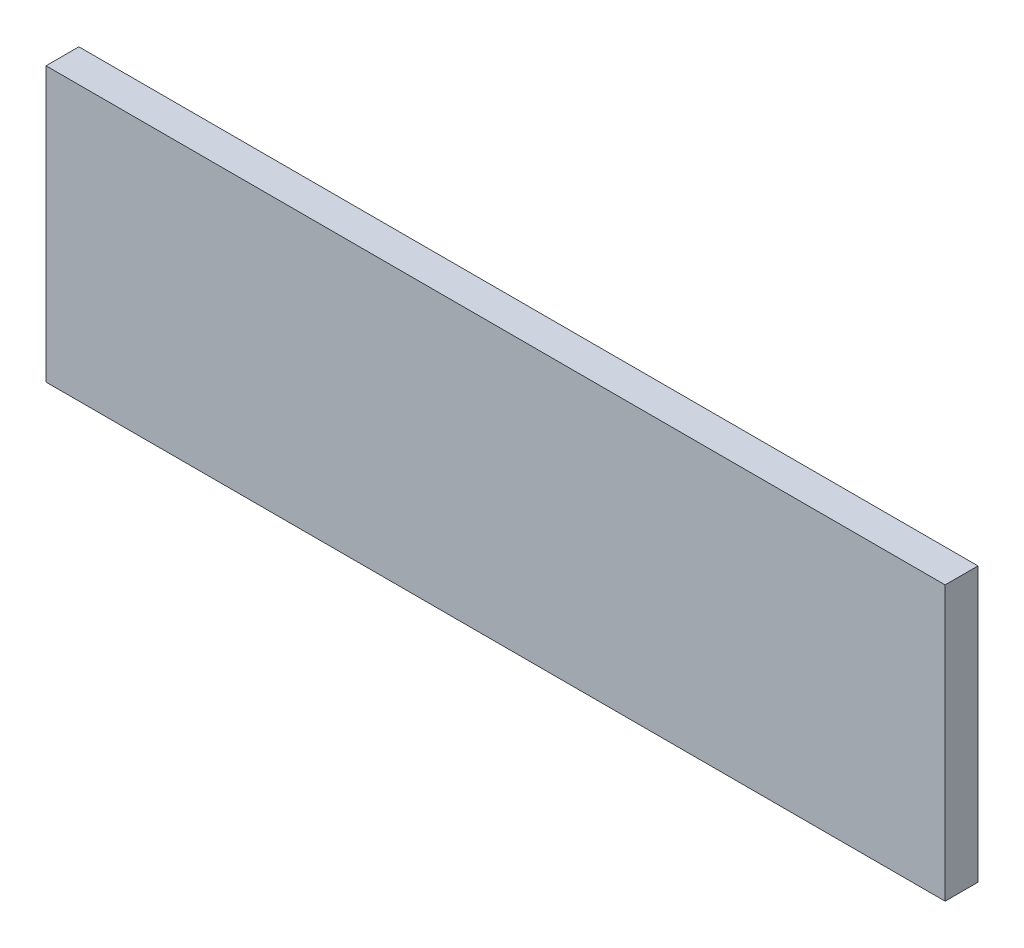
from build123d import *

# Parameters (mm, degrees)
SKETCH_1_W      = 164.1
SKETCH_1_H      = 50
EXTRUDE_1_DEPTH = 6


with BuildPart() as part:
    # Эскиз1 → Бобышка-Вытянуть1 (new body)
    with BuildSketch(Plane.XY):
        Rectangle(SKETCH_1_W, SKETCH_1_H)
    extrude(amount=EXTRUDE_1_DEPTH)


solid = part.part
